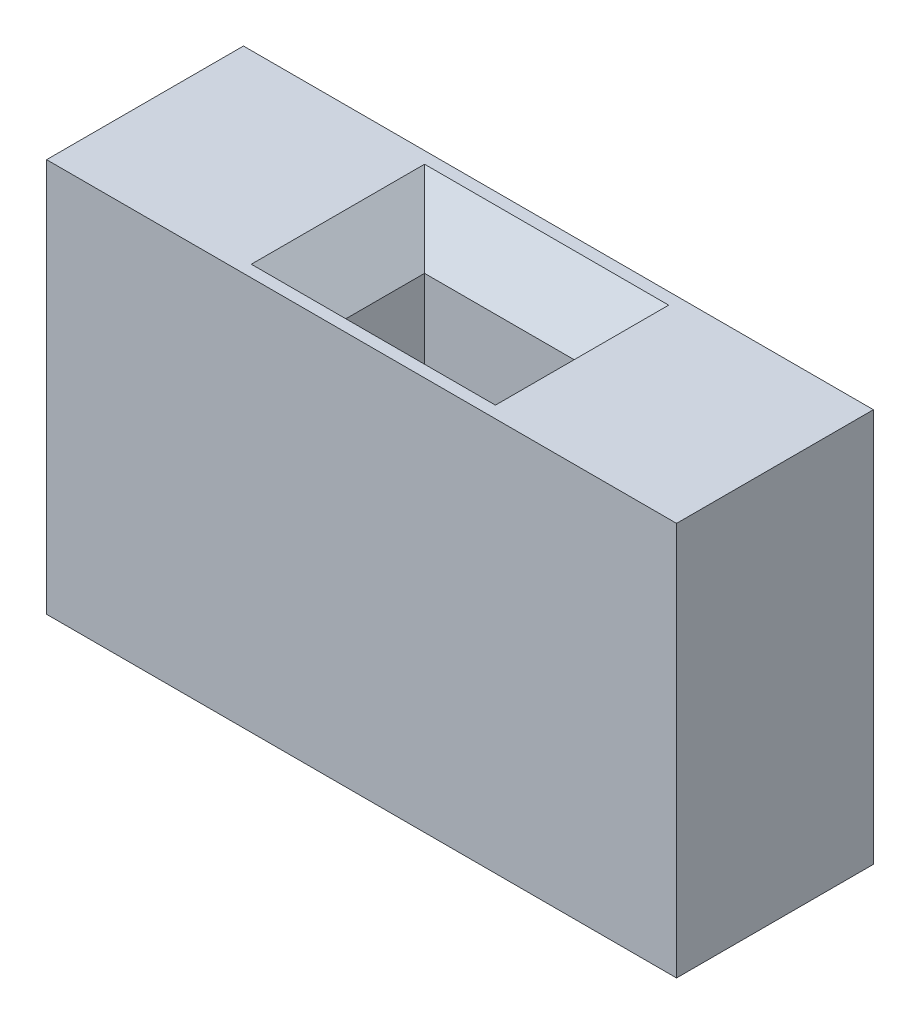
from build123d import *

# Parameters (mm, degrees)
SKETCH1_W           = 0.08
SKETCH1_H           = 0.025
BOSS_EXTRUDE1_DEPTH = 0.025
SKETCH2_W           = 0.019
SKETCH2_H           = 0.01
CUT_EXTRUDE1_DEPTH  = 0.04
CHAMFER1_SIZE       = 0.006


with BuildPart() as part:
    # Sketch1 → Boss-Extrude1 (new, symmetric)
    with BuildSketch(Plane(origin=(0, 0, 0), x_dir=(1, 0, 0), z_dir=(0, 1, 0))):
        Rectangle(SKETCH1_W, SKETCH1_H)
    extrude(amount=BOSS_EXTRUDE1_DEPTH, both=True)

    # Sketch2 → Cut-Extrude1 (cut)
    with BuildSketch(Plane(origin=(0, 0.025, 0), x_dir=(1, 0, 0), z_dir=(0, 1, 0))):
        Rectangle(SKETCH2_W, SKETCH2_H)
    extrude(amount=-CUT_EXTRUDE1_DEPTH, mode=Mode.SUBTRACT)

    # Chamfer1
    chamfer1_edges = [part.edges().sort_by_distance(p)[0] for p in [
        (0.0095, 0.025, 0),
        (0, 0.025, -0.005),
        (-0.0095, 0.025, 0),
        (0, 0.025, 0.005),
    ]]
    chamfer(chamfer1_edges, length=CHAMFER1_SIZE)


solid = part.part
